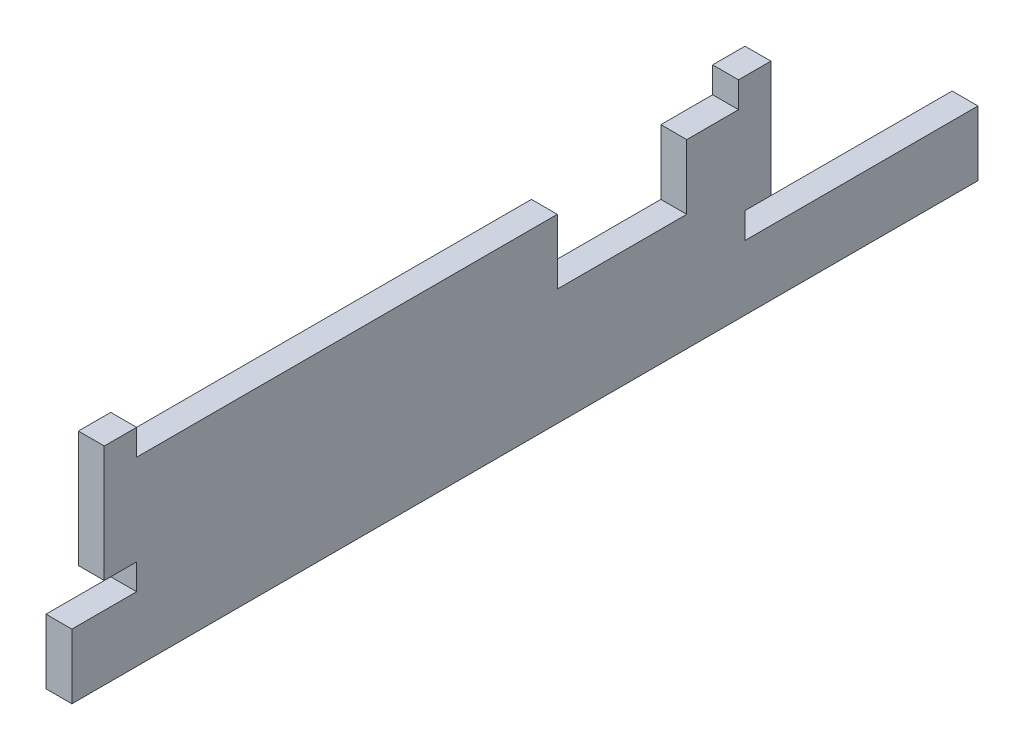
from build123d import *

# Parameters (mm, degrees)
BOSS_EXTRUDE1_DEPTH = 4


with BuildPart() as part:
    # Sketch1 → Boss-Extrude1 (new body)
    with BuildSketch(Plane(origin=(0, 0, 0), x_dir=(0, 0, -1), z_dir=(1, 0, 0))):
        Polygon((-95.831013652, 23.344821468), (-95.831013652, 5.344821468), (-90.831013652, 5.344821468), (-90.831013652, 1.344821468), (-100.831013652, 1.344821468), (-100.831013652, -8.655178532), (39.168986348, -8.655178532), (39.168986348, 1.344821468), (3.168986348, 1.344821468), (3.168986348, 5.344821468), (7.168986348, 5.344821468), (7.168986348, 23.344821468), (2.168986348, 23.344821468), (2.168986348, 19.344821468), (-5.831013652, 19.344821468), (-5.831013652, 9.344821468), (-25.831013652, 9.344821468), (-25.831013652, 19.344821468), (-90.831013652, 19.344821468), (-90.831013652, 23.344821468), align=None)
    extrude(amount=BOSS_EXTRUDE1_DEPTH)


solid = part.part
